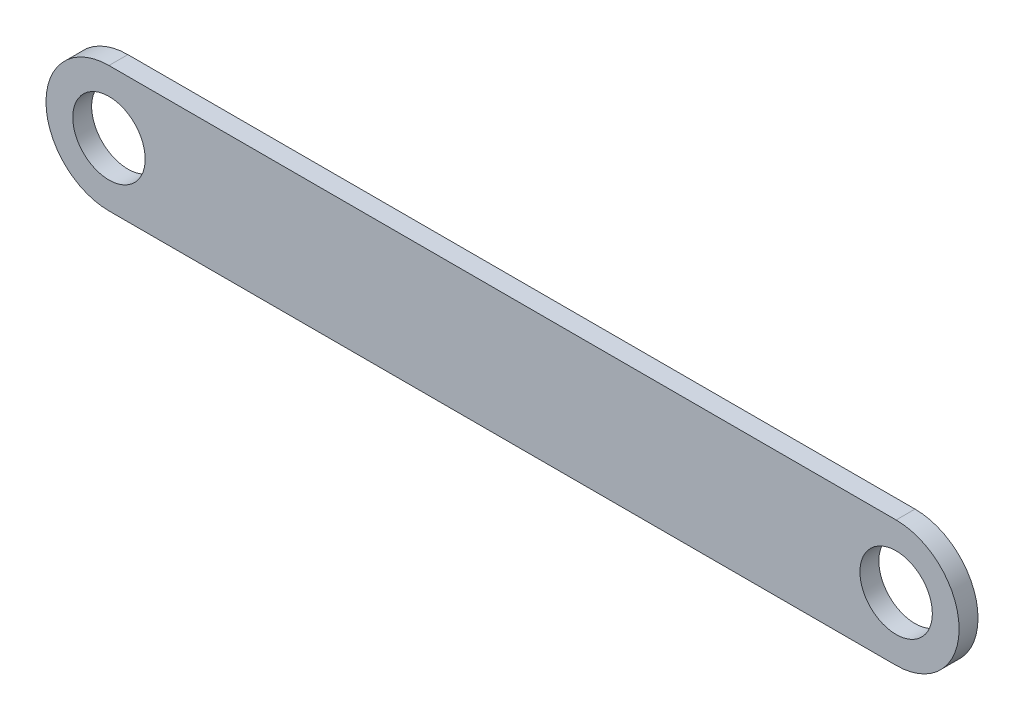
from build123d import *

# Parameters (mm, degrees)
SKETCH1_R           = 5.75
BOSS_EXTRUDE1_DEPTH = 3


with BuildPart() as part:
    # Sketch1 → Boss-Extrude1 (new body)
    with BuildSketch(Plane.XY):
        with BuildLine():
            Line((-62.5, 10), (62.5, 10))
            ThreePointArc((62.5, 10), (72.5, 0), (62.5, -10))
            Line((62.5, -10), (-62.5, -10))
            ThreePointArc((-62.5, -10), (-72.5, 0), (-62.5, 10))
        make_face()
        with Locations((-62.5, 0)):
            Circle(SKETCH1_R, mode=Mode.SUBTRACT)
        with Locations((62.5, 0)):
            Circle(SKETCH1_R, mode=Mode.SUBTRACT)
    extrude(amount=BOSS_EXTRUDE1_DEPTH)


solid = part.part
